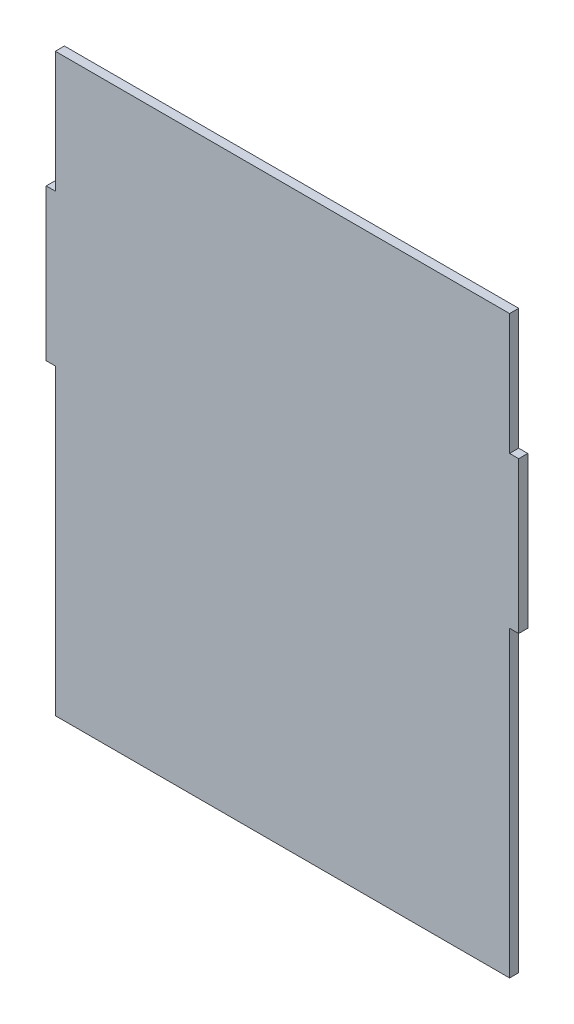
from build123d import *

# Parameters (mm, degrees)
SALIENTE_EXTRUIR1_DEPTH = 3


with BuildPart() as part:
    # Croquis1 → Saliente-Extruir1 (new body)
    with BuildSketch(Plane.XY):
        Polygon((0, 150), (0, 190), (150, 190), (150, 150), (153, 150), (153, 100), (150, 100), (150, 0), (0, 0), (0, 100), (-3, 100), (-3, 150), align=None)
    extrude(amount=SALIENTE_EXTRUIR1_DEPTH)


solid = part.part
